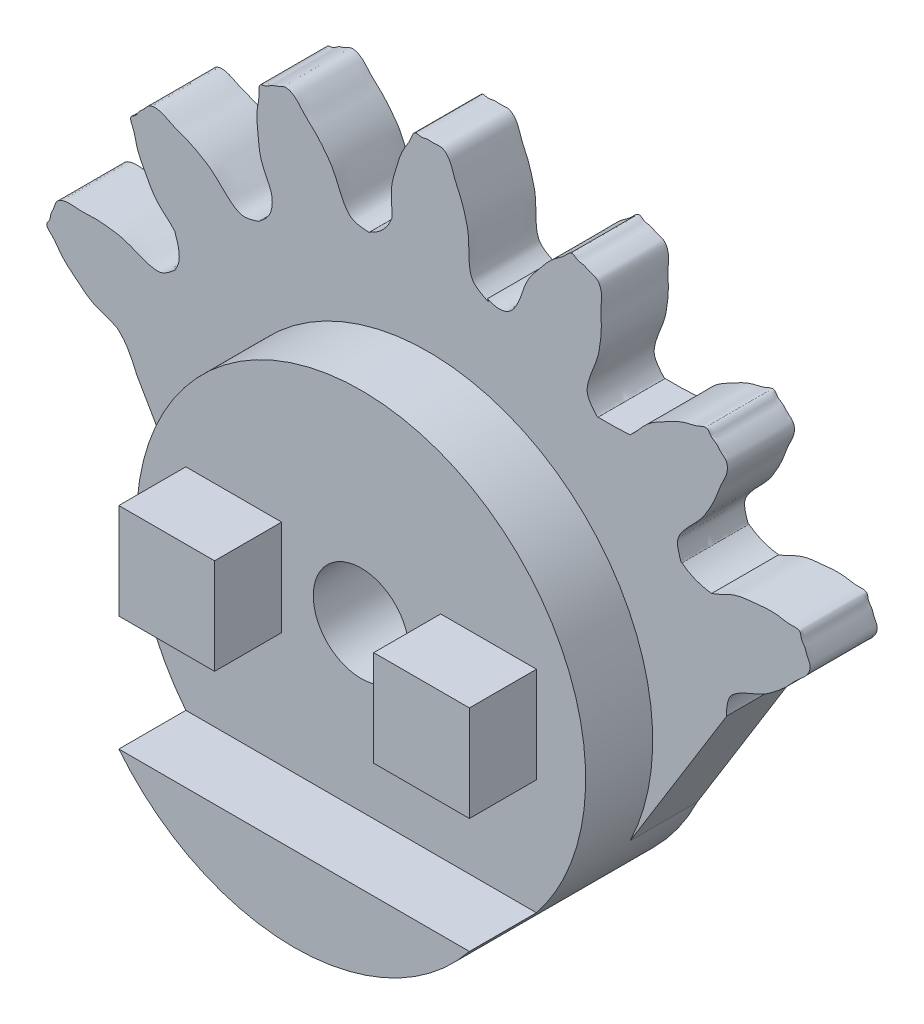
from build123d import *

# Parameters (mm, degrees)
EXTRUDE_1_DEPTH     = 70
EXTRUDE_START       = 70
EXTRUDE_2_DEPTH     = 70
SKETCH_3_W          = 100
SKETCH_3_H          = 100
EXTRUDE_3_DEPTH     = 70
CUT_EXTRUDE_1_DEPTH = 1092.257906172
EXTRUDE_4_DEPTH     = 70


with BuildPart() as part:
    # 草图2 → 凸台-拉伸1 (new body)
    with BuildSketch(Plane.XY):
        with BuildLine():
            Line((126.945258472, 329.128229646), (215.906156818, 175.215682916))
            ThreePointArc((215.906156818, 175.215682916), (425.859375662, 33.630551408), (642.078424949, 165.448707566))
            Line((642.078424949, 165.448707566), (743.279997097, 329.128229646))
            add(Edge.make_bspline(
                [(727.26960371, 431.787012729), (735.545221409, 434.40718163), (748.608312337, 443.382319066), (768.158171223, 445.312592986), (783.493535682, 447.030746042), (796.925556023, 447.011968941), (807.910731045, 443.930619325), (820.423714538, 445.828171758), (820.337613441, 436.561057713), (825.051199472, 432.42459638), (826.465558907, 424.931445799), (831.364963849, 418.940476903), (827.774091857, 406.492246315), (816.680993096, 399.321742945), (806.42120345, 386.938066483), (795.578726057, 377.554278194), (782.639896567, 367.787106375), (766.326385458, 361.025050296), (747.422505699, 352.670051261), (743.3607846, 341.617225454), (742.29957305, 328.265039658), (743.279997097, 329.128229646)],
                knots=[0, 0, 0, 0, 0.102584595, 0.179325947, 0.22662372, 0.285832688, 0.331168857, 0.372898572, 0.392635161, 0.423372671, 0.442181388, 0.480630907, 0.505915616, 0.582868552, 0.628673871, 0.694970536, 0.751247122, 0.816716878, 0.908848875, 0.960270541, 0.992476785, 0.992476785, 0.992476785, 0.992476785], degree=3))
            add(Edge.make_bspline(
                [(696.155915179, 443.895100436), (709.852526619, 433.56102713), (727.26960371, 431.787012729)],
                knots=[0, 0, 0, 1, 1, 1], degree=2))
            add(Edge.make_bspline(
                [(642.078424949, 532.612536664), (648.721403531, 538.200198869), (657.355489471, 551.491173121), (674.67852011, 560.755920789), (688.189040749, 568.211877139), (700.605795108, 573.334741007), (711.933954918, 574.691789647), (722.76828238, 581.233410974), (726.23510635, 572.638764519), (732.172847229, 570.620983838), (736.347049546, 564.239467305), (743.166154035, 560.579454863), (744.612352505, 547.704622186), (737.10769845, 536.834795776), (732.367916602, 521.467519039), (725.941793967, 508.648792636), (717.725609063, 494.673626822), (705.241616877, 482.183391188), (690.97402899, 467.230176995), (691.451221317, 455.464344084), (695.580449976, 442.722424834), (696.155915179, 443.895100436)],
                knots=[0, 0, 0, 0, 0.102584595, 0.179325947, 0.22662372, 0.285832688, 0.331168857, 0.372898572, 0.392635161, 0.423372671, 0.442181388, 0.480630907, 0.505915616, 0.582868552, 0.628673871, 0.694970536, 0.751247122, 0.816716878, 0.908848875, 0.960270541, 0.992476785, 0.992476785, 0.992476785, 0.992476785], degree=3))
            add(Edge.make_bspline(
                [(608.699560371, 531.892257954), (625.402391659, 531.583624392), (642.078424949, 532.612536664)],
                knots=[0, 0, 0, 1, 1, 1], degree=2))
            add(Edge.make_bspline(
                [(524.787780972, 593.161921886), (528.786787167, 600.866406477), (531.677406803, 616.449787199), (544.136334813, 631.638534767), (553.765157337, 643.697192645), (563.276307421, 653.181787898), (573.22284238, 658.770636439), (580.729085668, 668.960424114), (587.221042181, 662.346702261), (593.478970686, 662.754791048), (599.777531422, 658.456436608), (607.478188613, 657.684584334), (613.741286939, 646.343226135), (610.967593139, 633.42890922), (612.469407909, 617.417560786), (611.437958952, 603.115431163), (609.195258305, 587.059863664), (602.441359683, 570.742973625), (594.982174589, 551.468035583), (599.925632136, 540.780436971), (608.616663373, 530.588625968), (608.699560371, 531.892257954)],
                knots=[0, 0, 0, 0, 0.102584595, 0.179325947, 0.22662372, 0.285832688, 0.331168857, 0.372898572, 0.392635161, 0.423372671, 0.442181388, 0.480630907, 0.505915616, 0.582868552, 0.628673871, 0.694970536, 0.751247122, 0.816716878, 0.908848875, 0.960270541, 0.992476785, 0.992476785, 0.992476785, 0.992476785], degree=3))
            add(Edge.make_bspline(
                [(524.787780972, 593.161921886), (515.300564705, 571.53280187), (493.029511897, 581.225463307)],
                knots=[0, 0, 0, 1, 1, 1], degree=2))
            add(Edge.make_bspline(
                [(393.254109081, 604.217073378), (394.000330448, 612.865442418), (390.707413143, 628.368801158), (396.405479677, 647.169199494), (400.686703142, 661.994737551), (405.844262569, 674.397120539), (412.894902894, 683.366917455), (415.930304512, 695.653568673), (424.45905204, 692.027650621), (430.084455283, 694.799481059), (437.548475662, 693.238674209), (444.958330305, 695.472489617), (455.084828543, 687.39122487), (457.464364734, 674.398505132), (464.979138438, 660.180667657), (469.499391912, 646.5725044), (473.571606366, 630.880849824), (473.57602115, 613.221403977), (474.06083216, 592.559176674), (483.088517345, 584.235229662), (496.85727748, 577.372524688), (493.029511897, 581.225463307)],
                knots=[0, 0, 0, 0, 0.102584595, 0.179325947, 0.22662372, 0.285832688, 0.331168857, 0.372898572, 0.392635161, 0.423372671, 0.442181388, 0.480630907, 0.505915616, 0.582868552, 0.628673871, 0.694970536, 0.751247122, 0.816716878, 0.908848875, 0.960270541, 1, 1, 1, 1], degree=3))
            add(Edge.make_bspline(
                [(393.254109081, 604.217073378), (387.178066023, 587.2760459), (370.16100155, 580.105337927)],
                knots=[0, 0, 0, 1, 1, 1], degree=2))
            add(Edge.make_bspline(
                [(267.502218468, 564.09494454), (264.882049566, 572.370562239), (255.90691213, 585.433653167), (253.97663821, 604.983512052), (252.258485154, 620.318876512), (252.277262255, 633.750896853), (255.358611871, 644.736071874), (253.461059438, 657.249055368), (262.728173483, 657.162954271), (266.864634816, 661.876540302), (274.357785397, 663.290899736), (280.348754293, 668.190304679), (292.796984881, 664.599432686), (299.967488251, 653.506333926), (312.351164713, 643.24654428), (321.734953002, 632.404066887), (331.502124821, 619.465237397), (338.2641809, 603.151726288), (346.619179935, 584.247846529), (357.672005742, 580.18612543), (371.024191538, 579.12491388), (370.16100155, 580.105337927)],
                knots=[0, 0, 0, 0, 0.102584595, 0.179325947, 0.22662372, 0.285832688, 0.331168857, 0.372898572, 0.392635161, 0.423372671, 0.442181388, 0.480630907, 0.505915616, 0.582868552, 0.628673871, 0.694970536, 0.751247122, 0.816716878, 0.908848875, 0.960270541, 0.992476785, 0.992476785, 0.992476785, 0.992476785], degree=3))
            add(Edge.make_bspline(
                [(267.502218468, 564.09494454), (271.791525414, 543.742850718), (255.39413076, 532.981256009)],
                knots=[0, 0, 0, 1, 1, 1], degree=2))
            add(Edge.make_bspline(
                [(166.676694533, 478.903765779), (161.089032327, 485.546744361), (147.798058075, 494.180830301), (138.533310407, 511.50386094), (131.077354057, 525.014381579), (125.954490189, 537.431135938), (124.597441549, 548.759295748), (118.055820222, 559.59362321), (126.650466677, 563.06044718), (128.668247358, 568.998188059), (135.049763891, 573.172390376), (138.709776333, 579.991494865), (151.58460901, 581.437693335), (162.45443542, 573.93303928), (177.821712157, 569.193257432), (190.64043856, 562.767134797), (204.615604374, 554.550949893), (217.105840008, 542.066957706), (232.059054201, 527.79936982), (243.824887112, 528.276562147), (256.566806362, 532.405790806), (255.39413076, 532.981256009)],
                knots=[0, 0, 0, 0, 0.102584595, 0.179325947, 0.22662372, 0.285832688, 0.331168857, 0.372898572, 0.392635161, 0.423372671, 0.442181388, 0.480630907, 0.505915616, 0.582868552, 0.628673871, 0.694970536, 0.751247122, 0.816716878, 0.908848875, 0.960270541, 0.992476785, 0.992476785, 0.992476785, 0.992476785], degree=3))
            add(Edge.make_bspline(
                [(166.676694533, 478.903765779), (170.386897441, 468.555444535), (174.484500757, 455.786646247), (167.396973242, 445.524901201)],
                knots=[0, 0, 0, 0, 1, 1, 1, 1], degree=3))
            add(Edge.make_bspline(
                [(106.12730931, 361.613121802), (98.422824719, 365.612127997), (82.839443997, 368.502747633), (67.650696429, 380.961675643), (55.592038551, 390.590498167), (46.107443298, 400.101648251), (40.518594757, 410.04818321), (30.328807082, 417.554426498), (36.942528935, 424.046383011), (36.534440148, 430.304311516), (40.832794588, 436.602872252), (41.604646862, 444.303529443), (52.946005061, 450.566627769), (65.860321976, 447.792933969), (81.87167041, 449.294748739), (96.173800033, 448.263299782), (112.229367532, 446.020599135), (128.546257571, 439.266700513), (147.821195613, 431.807515419), (158.508794225, 436.750972966), (168.700605228, 445.442004203), (167.396973242, 445.524901201)],
                knots=[0, 0, 0, 0, 0.102584595, 0.179325947, 0.22662372, 0.285832688, 0.331168857, 0.372898572, 0.392635161, 0.423372671, 0.442181388, 0.480630907, 0.505915616, 0.582868552, 0.628673871, 0.694970536, 0.751247122, 0.816716878, 0.908848875, 0.960270541, 0.992476785, 0.992476785, 0.992476785, 0.992476785], degree=3))
            add(Edge.make_bspline(
                [(106.12730931, 361.613121802), (116.502085083, 353.24427028), (121.890662952, 340.995406382), (126.945258472, 329.128229646)],
                knots=[0, 0, 0, 0, 1, 1, 1, 1], degree=3))
        make_face()
    extrude(amount=-EXTRUDE_1_DEPTH)

    # 草图2<3> → 凸台-拉伸2 (add)
    with BuildSketch(Plane.XY.offset(EXTRUDE_START)):
        with BuildLine():
            ThreePointArc((649.794278949, 353), (431.231945183, 502.545576553), (212.669611417, 353))
            Line((212.669611417, 353), (649.794278949, 353))
        make_face()
        with BuildLine():
            Line((649.794278949, 353), (212.669611417, 353))
            ThreePointArc((212.669611417, 353), (196.782501844, 263.789157755), (215.906156818, 175.215682916))
            ThreePointArc((215.906156818, 175.215682916), (425.859375662, 33.630551408), (642.078424949, 165.448707566))
            ThreePointArc((642.078424949, 165.448707566), (659.733355471, 215.408792237), (665.720235724, 268.057286013))
            ThreePointArc((665.720235724, 268.057286013), (661.704358306, 311.268687167), (649.794278949, 353))
        make_face()
        with BuildLine():
            ThreePointArc((649.794278949, 353), (431.231945183, 502.545576553), (212.669611417, 353))
            Line((212.669611417, 353), (649.794278949, 353))
        make_face()
        with BuildLine():
            Line((649.794278949, 353), (212.669611417, 353))
            ThreePointArc((212.669611417, 353), (196.782501844, 263.789157755), (215.906156818, 175.215682916))
            ThreePointArc((215.906156818, 175.215682916), (425.859375662, 33.630551408), (642.078424949, 165.448707566))
            ThreePointArc((642.078424949, 165.448707566), (659.733355471, 215.408792237), (665.720235724, 268.057286013))
            ThreePointArc((665.720235724, 268.057286013), (661.704358306, 311.268687167), (649.794278949, 353))
        make_face()
    extrude(amount=-EXTRUDE_2_DEPTH)

    # 草图3 → 凸台-拉伸3 (add)
    with BuildSketch(Plane.XY.offset(70)):
        with Locations((298.16266484, 291.770374542)):
            Rectangle(SKETCH_3_W, SKETCH_3_H)
        with Locations((564.301225526, 291.770374542)):
            Rectangle(SKETCH_3_W, SKETCH_3_H)
    extrude(amount=EXTRUDE_3_DEPTH)

    # 草图3<3> → 切除-拉伸1 (cut, through all)
    with BuildSketch(Plane.XY.offset(70)):
        with BuildLine():
            ThreePointArc((431.231945183, 341.770374542), (381.231945183, 291.770374542), (431.231945183, 241.770374542))
            Line((431.231945183, 241.770374542), (431.231945183, 341.770374542))
        make_face()
        with BuildLine():
            Line((431.231945183, 341.770374542), (431.231945183, 241.770374542))
            ThreePointArc((431.231945183, 241.770374542), (466.587284242, 256.415035483), (481.231945183, 291.770374542))
            ThreePointArc((481.231945183, 291.770374542), (466.587284242, 327.125713602), (431.231945183, 341.770374542))
        make_face()
        with BuildLine():
            ThreePointArc((431.231945183, 341.770374542), (381.231945183, 291.770374542), (431.231945183, 241.770374542))
            Line((431.231945183, 241.770374542), (431.231945183, 341.770374542))
        make_face()
        with BuildLine():
            Line((431.231945183, 341.770374542), (431.231945183, 241.770374542))
            ThreePointArc((431.231945183, 241.770374542), (466.587284242, 256.415035483), (481.231945183, 291.770374542))
            ThreePointArc((481.231945183, 291.770374542), (466.587284242, 327.125713602), (431.231945183, 341.770374542))
        make_face()
    extrude(amount=-CUT_EXTRUDE_1_DEPTH, mode=Mode.SUBTRACT)

    # 草图3<5> → 凸台-拉伸4 (add, through all)
    with BuildSketch(Plane.XY.offset(70)):
        with BuildLine():
            ThreePointArc((248.16266484, 121.529483206), (329.679731018, 56.699990897), (431.231945183, 33.568995472))
            Line((431.231945183, 33.568995472), (431.231945183, 121.529483206))
            Line((431.231945183, 121.529483206), (248.16266484, 121.529483206))
        make_face()
        with BuildLine():
            Line((431.231945183, 121.529483206), (431.231945183, 33.568995472))
            ThreePointArc((431.231945183, 33.568995472), (532.784159349, 56.699990897), (614.301225526, 121.529483206))
            Line((614.301225526, 121.529483206), (431.231945183, 121.529483206))
        make_face()
        with BuildLine():
            ThreePointArc((248.16266484, 121.529483206), (329.679731018, 56.699990897), (431.231945183, 33.568995472))
            Line((431.231945183, 33.568995472), (431.231945183, 121.529483206))
            Line((431.231945183, 121.529483206), (248.16266484, 121.529483206))
        make_face()
        with BuildLine():
            Line((431.231945183, 121.529483206), (431.231945183, 33.568995472))
            ThreePointArc((431.231945183, 33.568995472), (532.784159349, 56.699990897), (614.301225526, 121.529483206))
            Line((614.301225526, 121.529483206), (431.231945183, 121.529483206))
        make_face()
    extrude(amount=EXTRUDE_4_DEPTH)


solid = part.part
